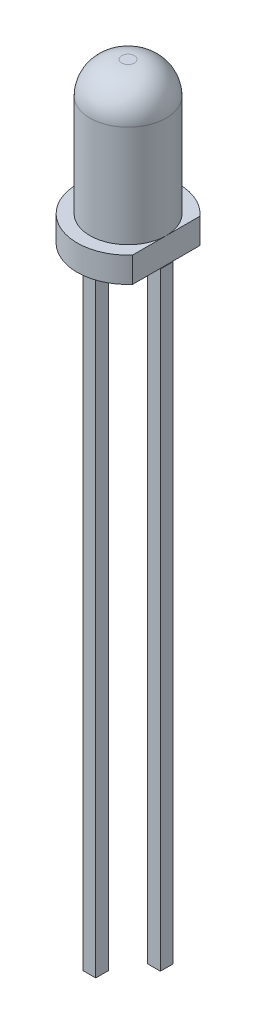
from build123d import *

# Parameters (mm, degrees)
CROQUIS1_R           = 2
BASE_DEPTH           = 1
CROQUIS2_R           = 1.5
CUERPO_DEL_LED_DEPTH = 5.25
CROQUIS3_W           = 0.5
CROQUIS3_H           = 0.5
PINES_DEPTH          = 25.4
CROQUIS4_W           = 0.5
CROQUIS4_H           = 0.5
CORTE_A_CATODO_DEPTH = 1.5
CROQUIS6_W           = 1
CROQUIS6_H           = 4.5
RANURA_DEPTH         = 1
PUNTA_DEL_LED_R      = 1.25


with BuildPart() as part:
    # Croquis1 → Base (new body)
    with BuildSketch(Plane(origin=(0, 0, 0), x_dir=(1, 0, 0), z_dir=(0, 1, 0))):
        with Locations(Location((0, 0, 0), (0, 0, 270))):
            Circle(CROQUIS1_R)
    extrude(amount=BASE_DEPTH)

    # Croquis2 → Cuerpo del LED (add)
    with BuildSketch(Plane(origin=(0, 1, 0), x_dir=(1, 0, 0), z_dir=(0, 1, 0))):
        with Locations(Location((0, 0, 0), (0, 0, 90))):
            Circle(CROQUIS2_R)
    extrude(amount=CUERPO_DEL_LED_DEPTH)

    # Croquis3 → Pines (add)
    with BuildSketch(Plane.XZ):
        with Locations((-1.270142923, 0)):
            Rectangle(CROQUIS3_W, CROQUIS3_H)
        with Locations((1.270172723, 0)):
            Rectangle(CROQUIS3_W, CROQUIS3_H)
    extrude(amount=PINES_DEPTH)

    # Croquis4 → Corte a Catodo (cut)
    with BuildSketch(Plane.XZ.offset(25.4)):
        with Locations((1.270172723, 0)):
            Rectangle(CROQUIS4_W, CROQUIS4_H)
    extrude(amount=-CORTE_A_CATODO_DEPTH, mode=Mode.SUBTRACT)

    # Croquis6 → Ranura (cut)
    with BuildSketch(Plane(origin=(0, 1, 0), x_dir=(1, 0, 0), z_dir=(0, 1, 0))):
        with Locations((2, 0.48044739)):
            Rectangle(CROQUIS6_W, CROQUIS6_H)
    extrude(amount=-RANURA_DEPTH, mode=Mode.SUBTRACT)

    # Punta del Led
    punta_del_led_edges = [part.edges().sort_by_distance(p)[0] for p in [
        (0, 6.25, 1.5),
    ]]
    fillet(punta_del_led_edges, radius=PUNTA_DEL_LED_R)


solid = part.part
